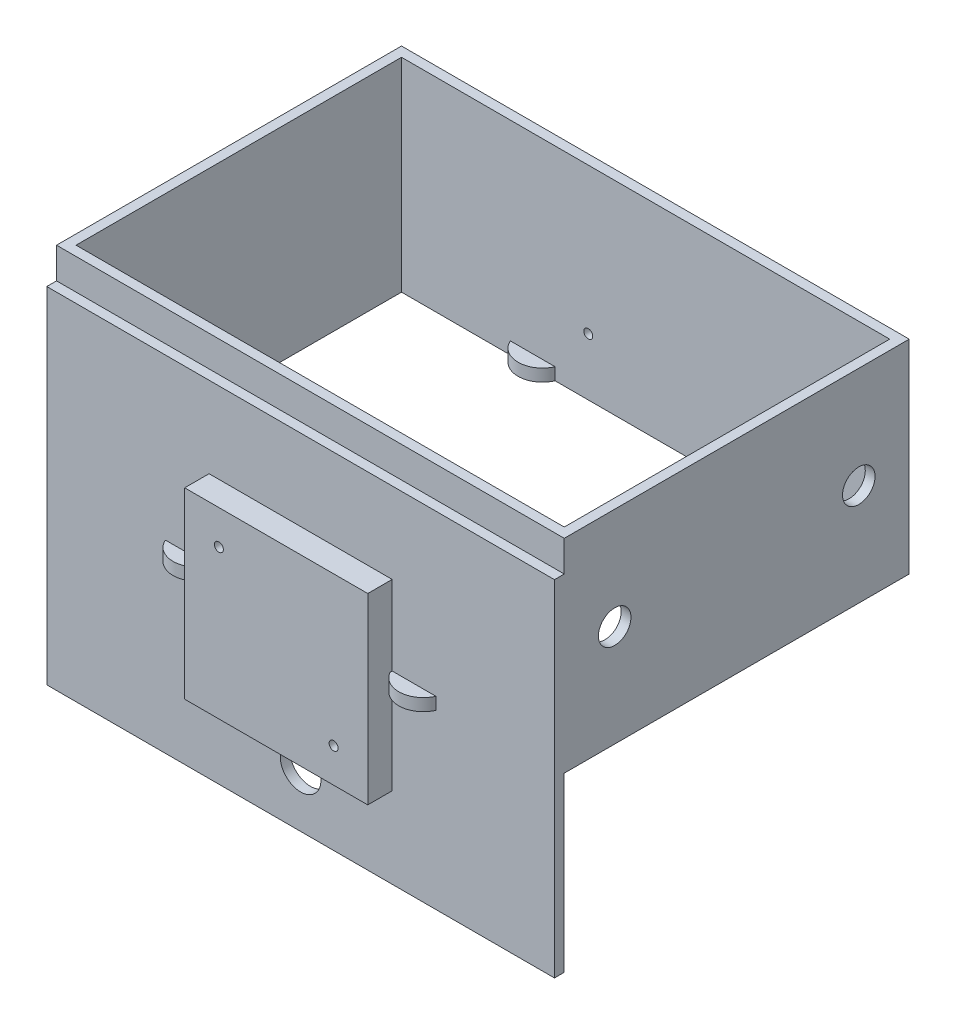
from build123d import *

# Parameters (mm, degrees)
SKETCH1_W           = 124.8
SKETCH1_H           = 84.8
SKETCH1_W_2         = 120
SKETCH1_H_2         = 80
BOSS_EXTRUDE1_DEPTH = 50
SKETCH2_W           = 124.8
SKETCH2_H           = 84.8
BOSS_EXTRUDE2_DEPTH = 2.4
SKETCH3_W           = 45
SKETCH3_H           = 45
BOSS_EXTRUDE3_DEPTH = 6
SKETCH4_R           = 1.1
SKETCH4_R_2         = 5
CUT_EXTRUDE1_DEPTH  = 123.800651464
SKETCH5_R           = 4
CUT_EXTRUDE2_DEPTH  = 3
SKETCH6_R           = 6
BOSS_EXTRUDE4_DEPTH = 3


with BuildPart() as part:
    # Sketch1 → Boss-Extrude1 (new body)
    with BuildSketch(Plane(origin=(0, 0, 0), x_dir=(1, 0, 0), z_dir=(0, 1, 0))):
        Rectangle(SKETCH1_W, SKETCH1_H)
        Rectangle(SKETCH1_W_2, SKETCH1_H_2, mode=Mode.SUBTRACT)
    extrude(amount=BOSS_EXTRUDE1_DEPTH)

    # Sketch2 → Boss-Extrude2 (add)
    with BuildSketch(Plane.XY.offset(42.4)):
        Rectangle(SKETCH2_W, SKETCH2_H)
    extrude(amount=BOSS_EXTRUDE2_DEPTH)

    # Sketch3 → Boss-Extrude3 (add)
    with BuildSketch(Plane.XY.offset(44.8)):
        Rectangle(SKETCH3_W, SKETCH3_H)
    extrude(amount=BOSS_EXTRUDE3_DEPTH)

    # Sketch4 → Cut-Extrude1 (cut, through all)
    with BuildSketch(Plane.XY.offset(50.8)):
        with Locations((-14.1, 14.1)):
            Circle(SKETCH4_R)
        with Locations((14.1, -14.1)):
            Circle(SKETCH4_R)
        with Locations(Location((0, -29, 0), (0, 0, 180))):
            Circle(SKETCH4_R_2)
    extrude(amount=-CUT_EXTRUDE1_DEPTH, mode=Mode.SUBTRACT)

    # Sketch5 → Cut-Extrude2 (cut)
    with BuildSketch(Plane(origin=(62.4, 0, 0), x_dir=(0, 0, -1), z_dir=(1, 0, 0))):
        with Locations((-30, 25)):
            Circle(SKETCH5_R)
        with Locations((30, 25)):
            Circle(SKETCH5_R)
    extrude(amount=-CUT_EXTRUDE2_DEPTH, mode=Mode.SUBTRACT)

    # Sketch6 → Boss-Extrude4 (add)
    with BuildSketch(Plane(origin=(0, 0, 0), x_dir=(1, 0, 0), z_dir=(0, 1, 0))):
        with Locations((-27.75, -42.4)):
            Circle(SKETCH6_R)
        with Locations((27.75, -42.4)):
            Circle(SKETCH6_R)
        with Locations((-27.75, 42.4)):
            Circle(SKETCH6_R)
        with Locations((27.75, 42.4)):
            Circle(SKETCH6_R)
    extrude(amount=BOSS_EXTRUDE4_DEPTH)


solid = part.part
